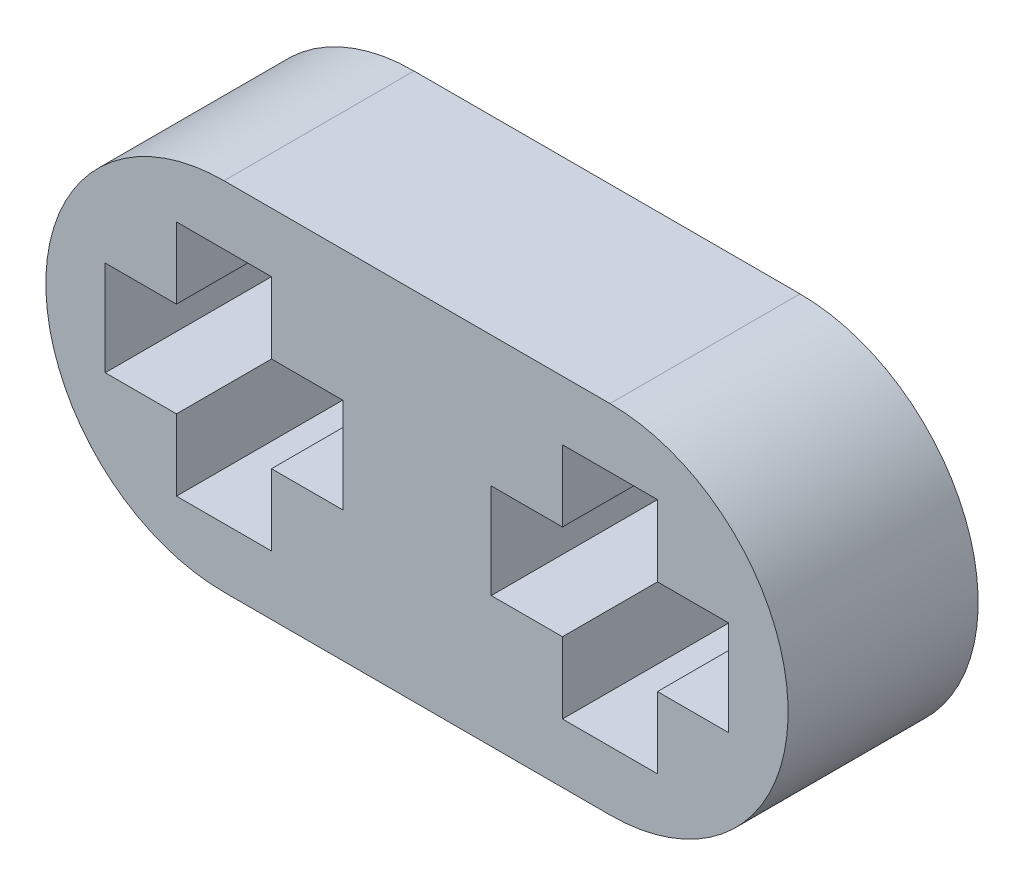
from build123d import *

# Parameters (mm, degrees)
BOSS_EXTRUDE1_DEPTH = 4


with BuildPart() as part:
    # Sketch1 → Boss-Extrude1 (new body)
    with BuildSketch(Plane.XY):
        with BuildLine():
            Line((0, 3.75), (8.125, 3.75))
            ThreePointArc((8.125, 3.75), (11.875, 0), (8.125, -3.75))
            Line((8.125, -3.75), (0, -3.75))
            ThreePointArc((0, -3.75), (-3.75, 0), (0, 3.75))
        make_face()
        Polygon((8.125, 2.5), (9.125, 2.5), (9.125, 1), (10.625, 1), (10.625, -1), (9.125, -1), (9.125, -2.5), (7.125, -2.5), (7.125, -1), (5.625, -1), (5.625, 1), (7.125, 1), (7.125, 2.5), align=None, mode=Mode.SUBTRACT)
        Polygon((1, 1), (1, 2.5), (0, 2.5), (-1, 2.5), (-1, 1), (-2.5, 1), (-2.5, -1), (-1, -1), (-1, -2.5), (1, -2.5), (1, -1), (2.5, -1), (2.5, 1), align=None, mode=Mode.SUBTRACT)
    extrude(amount=BOSS_EXTRUDE1_DEPTH)


solid = part.part
